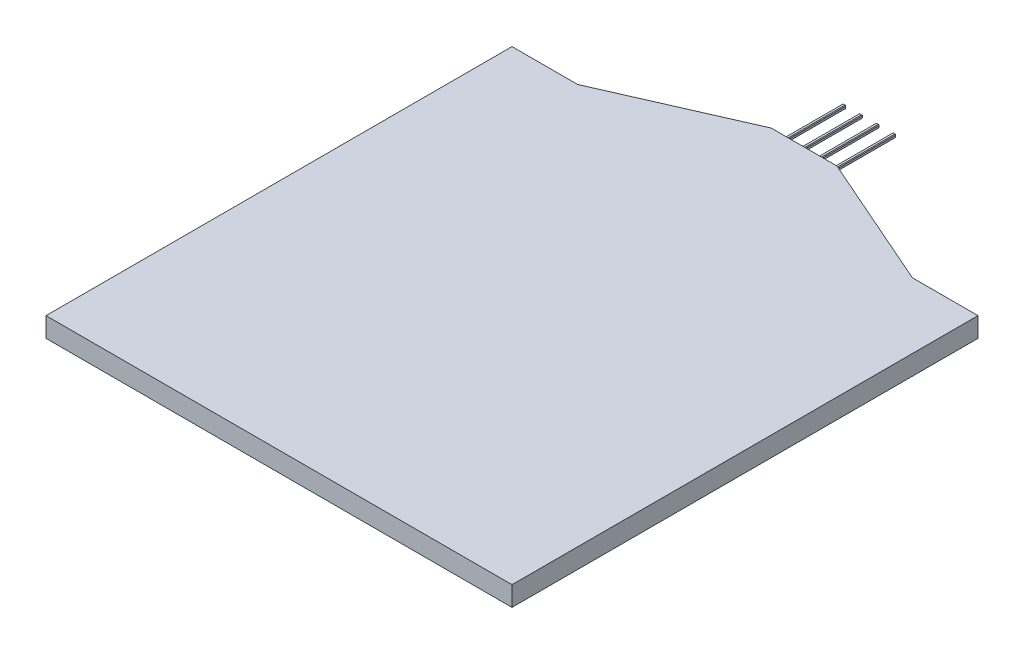
from build123d import *

# Parameters (mm, degrees)
BOSS_EXTRUDE1_DEPTH = 3
SKETCH2_W           = 0.5
SKETCH2_H           = 0.5
BOSS_EXTRUDE2_DEPTH = 10
CHAMFER1_SIZE       = 0.1


with BuildPart() as part:
    # Sketch1 → Boss-Extrude1 (new body)
    with BuildSketch(Plane(origin=(0, 0, 0), x_dir=(1, 0, 0), z_dir=(0, 1, 0))):
        Polygon((-5, 44.5), (-25.5, 35.5), (25.5, 35.5), (5, 44.5), align=None)
        Polygon((-25.5, 35.5), (-35.5, 35.5), (-35.5, -35.5), (35.5, -35.5), (35.5, 35.5), (25.5, 35.5), align=None)
    extrude(amount=BOSS_EXTRUDE1_DEPTH)

    # Sketch2 → Boss-Extrude2 (add)
    with BuildSketch(Plane(origin=(0, 0, -44.5), x_dir=(-1, 0, 0), z_dir=(0, 0, -1))):
        with Locations((-3.81, 1.5)):
            Rectangle(SKETCH2_W, SKETCH2_H)
        with Locations((-1.27, 1.5)):
            Rectangle(SKETCH2_W, SKETCH2_H)
        with Locations((1.27, 1.5)):
            Rectangle(SKETCH2_W, SKETCH2_H)
        with Locations((3.81, 1.5)):
            Rectangle(SKETCH2_W, SKETCH2_H)
    extrude(amount=BOSS_EXTRUDE2_DEPTH)

    # Chamfer1
    chamfer1_edges = [part.edges().sort_by_distance(p)[0] for p in [
        (3.56, 1.5, -44.5),
        (3.56, 1.25, -49.5),
        (3.81, 1.75, -44.5),
        (3.56, 1.75, -49.5),
        (4.06, 1.5, -44.5),
        (4.06, 1.75, -49.5),
        (3.81, 1.25, -44.5),
        (4.06, 1.25, -49.5),
        (3.56, 1.5, -54.5),
        (3.81, 1.75, -54.5),
        (4.06, 1.5, -54.5),
        (3.81, 1.25, -54.5),
        (1.02, 1.5, -44.5),
        (1.02, 1.25, -49.5),
        (1.27, 1.75, -44.5),
        (1.02, 1.75, -49.5),
        (1.52, 1.5, -44.5),
        (1.52, 1.75, -49.5),
        (1.27, 1.25, -44.5),
        (1.52, 1.25, -49.5),
        (1.02, 1.5, -54.5),
        (1.27, 1.75, -54.5),
        (1.52, 1.5, -54.5),
        (1.27, 1.25, -54.5),
        (-1.52, 1.5, -44.5),
        (-1.52, 1.25, -49.5),
        (-1.27, 1.75, -44.5),
        (-1.52, 1.75, -49.5),
        (-1.02, 1.5, -44.5),
        (-1.02, 1.75, -49.5),
        (-1.27, 1.25, -44.5),
        (-1.02, 1.25, -49.5),
        (-1.52, 1.5, -54.5),
        (-1.27, 1.75, -54.5),
        (-1.02, 1.5, -54.5),
        (-1.27, 1.25, -54.5),
        (-4.06, 1.5, -44.5),
        (-4.06, 1.25, -49.5),
        (-3.81, 1.75, -44.5),
        (-4.06, 1.75, -49.5),
        (-3.56, 1.5, -44.5),
        (-3.56, 1.75, -49.5),
        (-3.81, 1.25, -44.5),
        (-3.56, 1.25, -49.5),
        (-4.06, 1.5, -54.5),
        (-3.81, 1.75, -54.5),
        (-3.56, 1.5, -54.5),
        (-3.81, 1.25, -54.5),
    ]]
    chamfer(chamfer1_edges, length=CHAMFER1_SIZE)


solid = part.part
